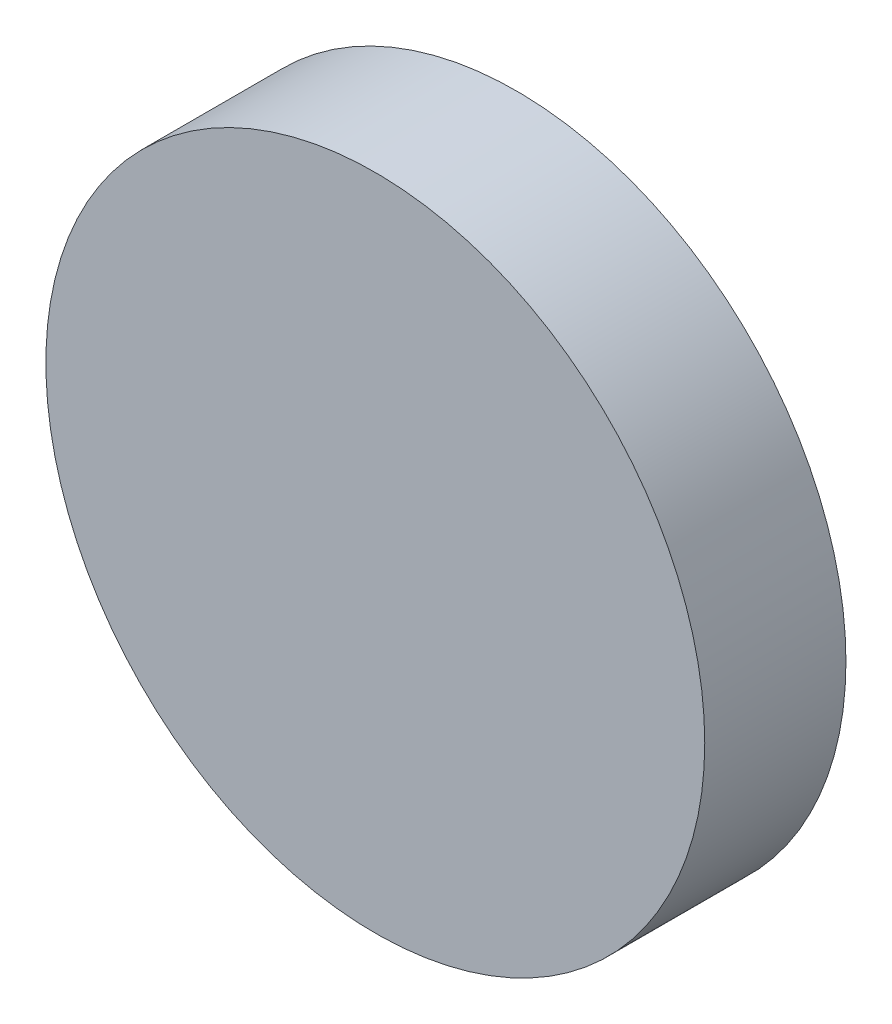
from build123d import *

# Parameters (mm, degrees)
SKETCH1_R             = 7
LASER_BASE_BODY_DEPTH = 3


with BuildPart() as part:
    # Sketch1 → Laser Base Body (new body)
    with BuildSketch(Plane.XY):
        Circle(SKETCH1_R)
    extrude(amount=LASER_BASE_BODY_DEPTH)


solid = part.part
